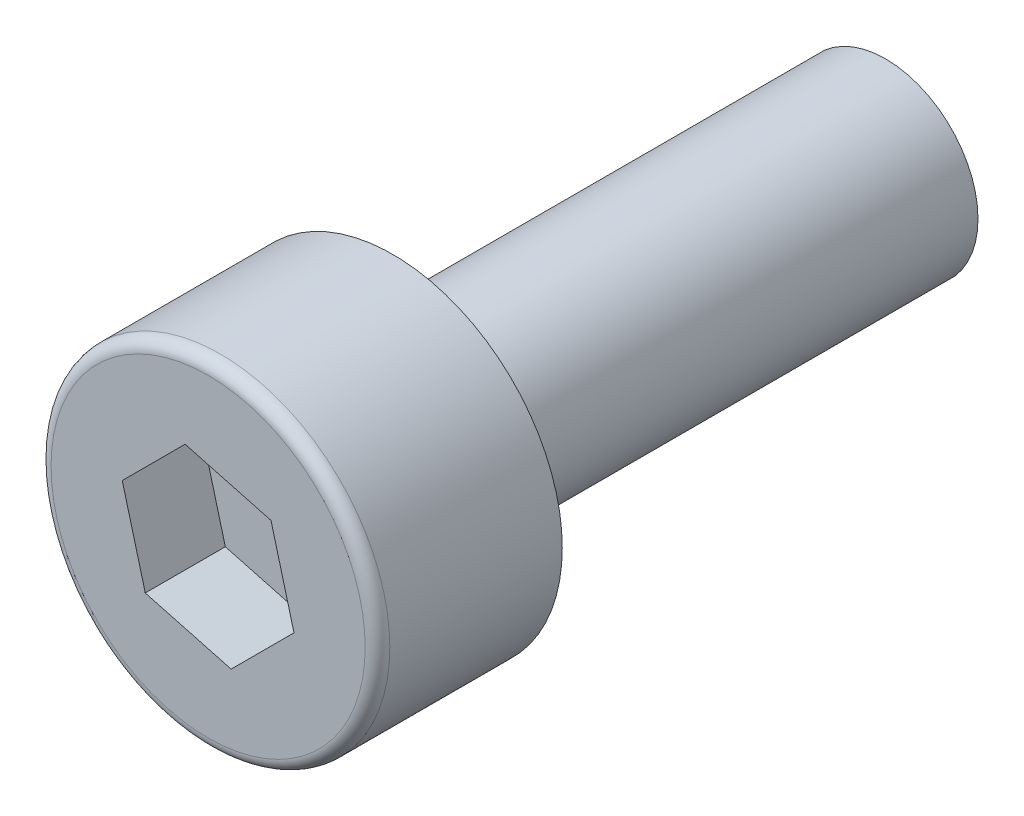
from build123d import *

# Parameters (mm, degrees)
SKETCH_1_R          = 2.75
EXTRUDE_1_DEPTH     = 3
CUT_EXTRUDE_1_DEPTH = 1.3
SKETCH_3_R          = 1.5
EXTRUDE_2_DEPTH     = 8
FILLET_1_R          = 0.2


with BuildPart() as part:
    # 草图1 → 凸台-拉伸1 (new body)
    with BuildSketch(Plane.XY):
        Circle(SKETCH_1_R)
    extrude(amount=EXTRUDE_1_DEPTH)

    # 草图2 → 切除-拉伸1 (cut)
    with BuildSketch(Plane.XY.offset(3)):
        Polygon((-1.020620726, -1.020620726), (0.373573113, -1.39419384), (1.39419384, -0.373573113), (1.020620726, 1.020620726), (-0.373573113, 1.39419384), (-1.39419384, 0.373573113), align=None)
    extrude(amount=-CUT_EXTRUDE_1_DEPTH, mode=Mode.SUBTRACT)

    # 草图3 → 凸台-拉伸2 (add)
    with BuildSketch(Plane(origin=(0, 0, 0), x_dir=(-1, 0, 0), z_dir=(0, 0, -1))):
        with Locations(Location((0, 0, 0), (0, 0, 180))):
            Circle(SKETCH_3_R)
    extrude(amount=EXTRUDE_2_DEPTH)

    # 圆角1
    fillet_1_edges = [part.edges().sort_by_distance(p)[0] for p in [
        (-2.75, 0, 3),
    ]]
    fillet(fillet_1_edges, radius=FILLET_1_R)


solid = part.part
